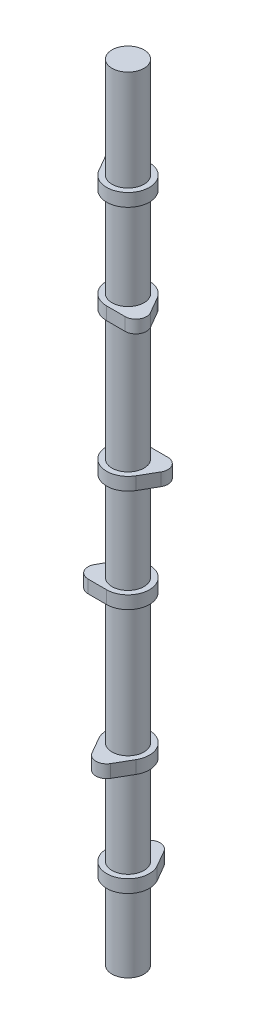
from build123d import *

# Parameters (mm, degrees)
BOSS_EXTRUDE1_DEPTH   = 3.81
BODY_MOVE_COPY2_ANGLE = 180
BOSS_EXTRUDE2_START   = -25.4
SKETCH3_R             = 9.5
BOSS_EXTRUDE2_DEPTH   = 146.05
LPATTERN1_COUNT       = 3
LPATTERN1_PITCH       = 146.05
BODY_MOVE_COPY3_ANGLE = 120
BODY_MOVE_COPY4_ANGLE = 120
BOSS_EXTRUDE3_START   = 27.94
SKETCH4_R             = 9.5
BOSS_EXTRUDE3_DEPTH   = 27.94


with BuildPart() as part:
    # Sketch2 → Boss-Extrude1 (new, symmetric)
    with BuildSketch(Plane(origin=(0, 0, 0), x_dir=(1, 0, 0), z_dir=(0, 1, 0))):
        with BuildLine():
            Line((-10.998522628, 6.35), (-5.499261314, 15.875))
            ThreePointArc((-5.499261314, 15.875), (0, 19.05), (5.499261314, 15.875))
            Line((5.499261314, 15.875), (10.998522628, 6.35))
            ThreePointArc((10.998522628, 6.35), (0, -12.7), (-10.998522628, 6.35))
        make_face()
    extrude(amount=BOSS_EXTRUDE1_DEPTH, both=True)


with BuildPart() as body_2:
    # Body-Move/Copy1: copy of part
    add(part.part.moved(Location((0, 60.96, 0))))


with BuildPart() as body_2_1:
    # Body-Move/Copy2: moved
    add(body_2.part.rotate(Axis((0, 0, 0), (0, 1, 0)), BODY_MOVE_COPY2_ANGLE))


with BuildPart() as part_1:
    add(part.part)

    add(body_2_1.part)  # Boss-Extrude2 merges body 2
    # Sketch3 → Boss-Extrude2 (add)
    with BuildSketch(Plane(origin=(0, 3.81, 0), x_dir=(1, 0, 0), z_dir=(0, 1, 0)).offset(BOSS_EXTRUDE2_START)):
        Circle(SKETCH3_R)
    extrude(amount=BOSS_EXTRUDE2_DEPTH)


with BuildPart() as lpattern1_1:
    # LPattern1: pattern copy
    add(part_1.part.moved(Location(Vector(0, 1, 0) * (1 * LPATTERN1_PITCH))))


with BuildPart() as lpattern1_2:
    # LPattern1: pattern copy
    add(part_1.part.moved(Location(Vector(0, 1, 0) * (2 * LPATTERN1_PITCH))))


with BuildPart() as lpattern1_1_1:
    # Body-Move/Copy3: moved
    add(lpattern1_1.part.rotate(Axis((0, 0, 0), (0, 1, 0)), BODY_MOVE_COPY3_ANGLE))


with BuildPart() as lpattern1_2_1:
    # Body-Move/Copy4: moved
    add(lpattern1_2.part.rotate(Axis((0, 0, 0), (0, -1, 0)), BODY_MOVE_COPY4_ANGLE))


with BuildPart() as part_2:
    add(part_1.part)

    # Sketch4 → Boss-Extrude3 (add)
    with BuildSketch(Plane.XZ.offset(21.59).offset(BOSS_EXTRUDE3_START)):
        Circle(SKETCH4_R)
    extrude(amount=-BOSS_EXTRUDE3_DEPTH)

    # Combine1: union LPattern1_1, LPattern1_2
    add(lpattern1_1_1.part)
    add(lpattern1_2_1.part)


solid = part_2.part
